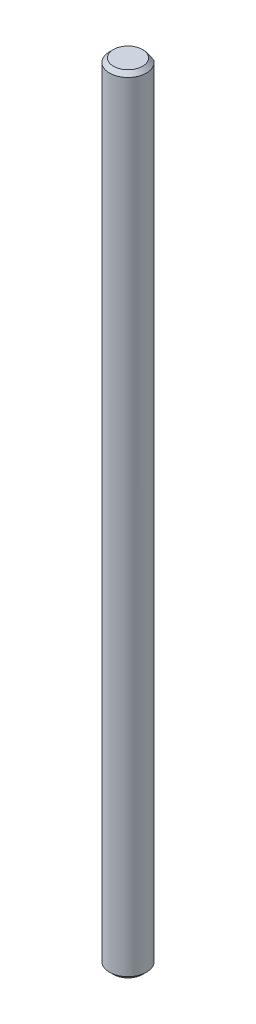
from build123d import *

# Parameters (mm, degrees)
CUT_EXTRUDE1_DEPTH = 101.055209759


with BuildPart() as part:
    # Sketch1 → Revolve1 (revolve)
    with BuildSketch(Plane.XY):
        Polygon((0, -50), (-1.85, -50), (-2.35, -49.5), (-2.35, 49.5), (-1.85, 50), (0, 50), align=None)
    revolve(axis=Axis((0, 50, 0), (0, -1, 0)))

    # Sketch2 → Cut-Extrude1 (cut, through all)
    with BuildSketch(Plane(origin=(0, 50, 0), x_dir=(1, 0, 0), z_dir=(0, 1, 0))):
        Polygon((-22.745021479, 1.87), (-1.42323575, 1.87), (1.42323575, 1.87), (22.745021479, 1.87), (22.745021479, 44.513571459), (-22.745021479, 44.513571459), align=None)
    extrude(amount=-CUT_EXTRUDE1_DEPTH, mode=Mode.SUBTRACT)


solid = part.part
